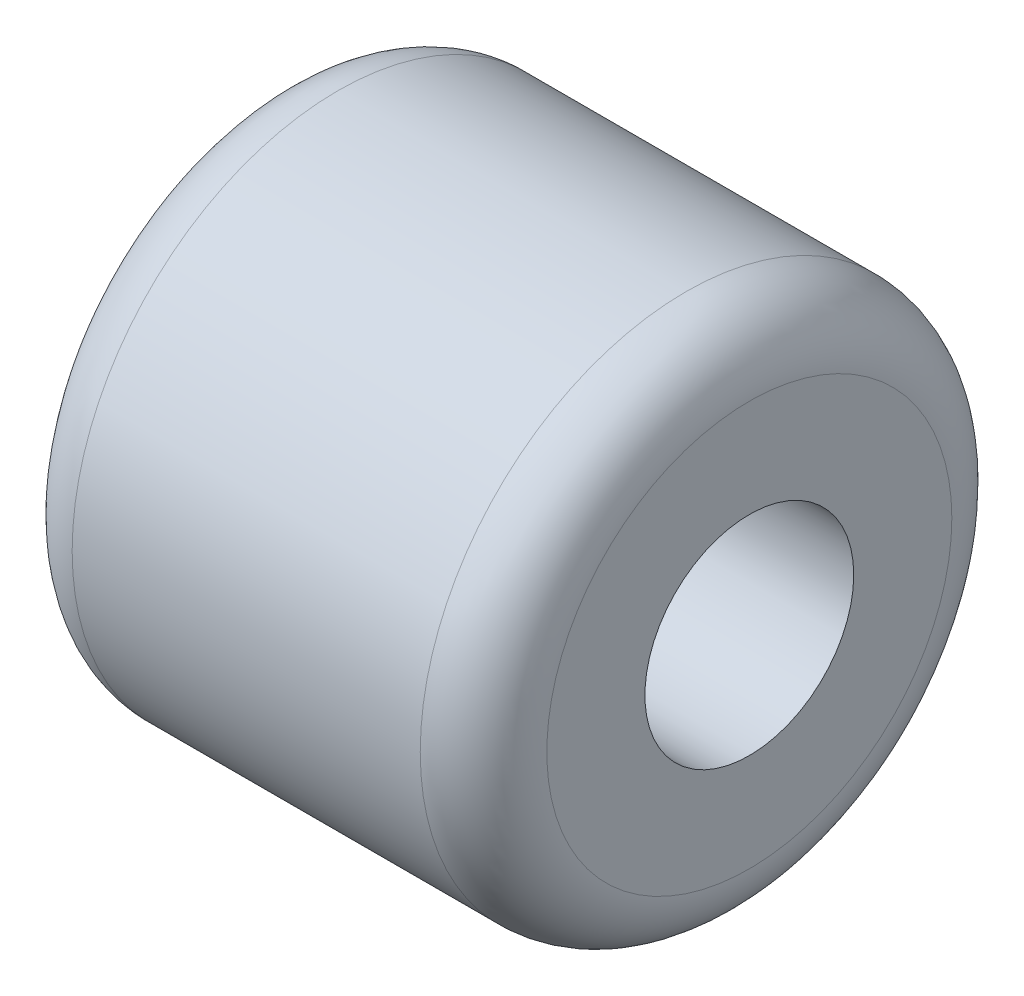
from build123d import *

# Parameters (mm, degrees)
SKETCH_1_R          = 8.4
EXTRUDE_1_DEPTH     = 7.5
SKETCH_2_R          = 3.3
CUT_EXTRUDE_1_DEPTH = 15
FILLET_1_R          = 2


with BuildPart() as part:
    # 草图1 → 凸台-拉伸1 (new, symmetric)
    with BuildSketch(Plane(origin=(0, 0, 0), x_dir=(0, 0, -1), z_dir=(1, 0, 0))):
        Circle(SKETCH_1_R)
    extrude(amount=EXTRUDE_1_DEPTH, both=True)

    # 草图2 → 切除-拉伸1 (cut)
    with BuildSketch(Plane(origin=(7.5, 0, 0), x_dir=(0, 0, -1), z_dir=(1, 0, 0))):
        Circle(SKETCH_2_R)
    extrude(amount=-CUT_EXTRUDE_1_DEPTH, mode=Mode.SUBTRACT)

    # 圆角1
    fillet_1_edges = [part.edges().sort_by_distance(p)[0] for p in [
        (-7.5, 0, 8.4),
        (7.5, 0, 8.4),
    ]]
    fillet(fillet_1_edges, radius=FILLET_1_R)


solid = part.part
